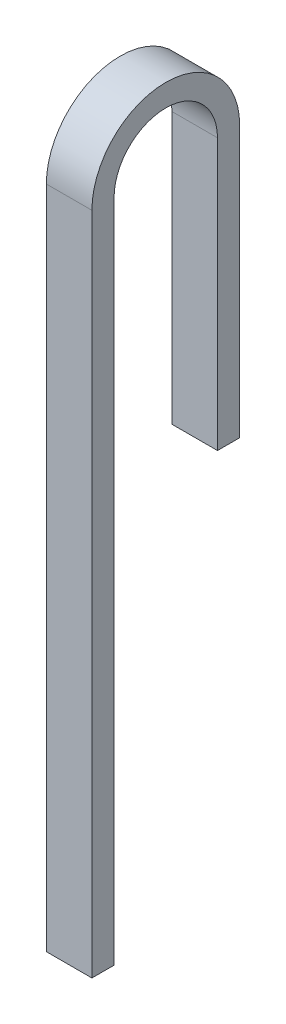
from build123d import *

# Parameters (mm, degrees)
WYCI_GNI_CIE_CIENKA_CIANKA1_DEPTH = 18.5


with BuildPart() as part:
    # Szkic1 → Wyciągnięcie-cienka ścianka1 (new, symmetric)
    with BuildSketch(Plane(origin=(0, 0, 0), x_dir=(0, 0, -1), z_dir=(1, 0, 0))):
        with BuildLine():
            Line((0, 0), (0, 220))
            ThreePointArc((0, 220), (-60, 280), (-120, 220))
            Line((-120, 220), (-120, -320))
            Line((-120, -320), (-102, -320))
            Line((-102, -320), (-102, 220))
            ThreePointArc((-102, 220), (-60, 262), (-18, 220))
            Line((-18, 220), (-18, 0))
            Line((-18, 0), (0, 0))
        make_face()
    extrude(amount=WYCI_GNI_CIE_CIENKA_CIANKA1_DEPTH, both=True)


solid = part.part
